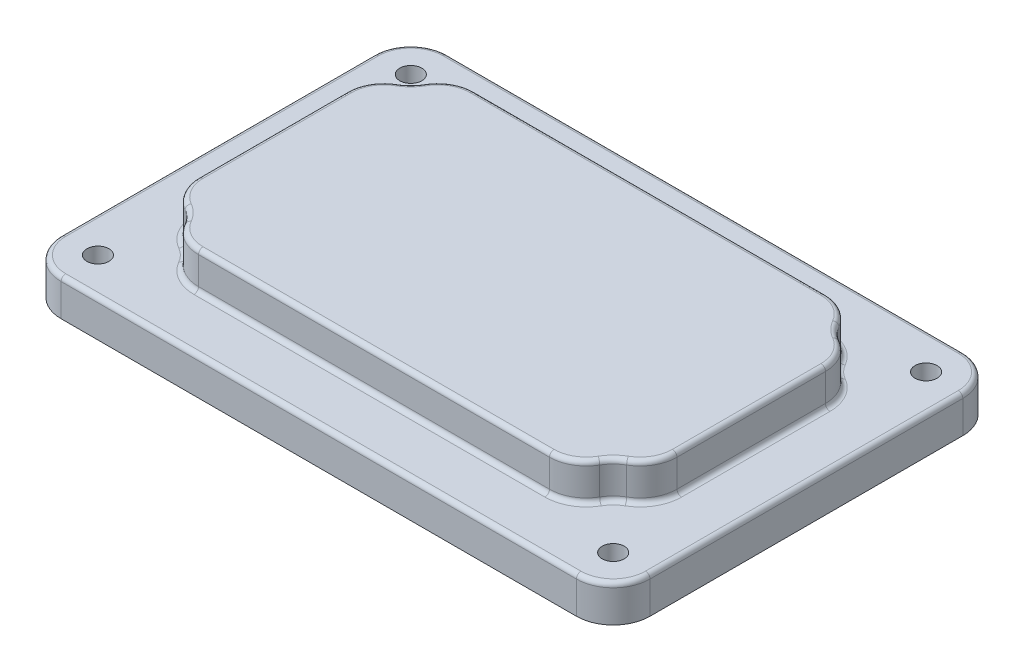
from build123d import *

# Parameters (mm, degrees)
BOSS_EXTRUDE1_DEPTH   = 6.35
SKETCH4_W             = 82.55
SKETCH4_H             = 47.625
BOSS_EXTRUDE2_DEPTH   = 6.35
SKETCH5_R             = 6.35
CUT_EXTRUDE1_DEPTH    = 6.35
FILLET1_R             = 6.35
SHELL1_T              = -3.175
BOSS_EXTRUDE3_REACH   = 64.075
SKETCH6_R             = 6.35
FILLET2_R             = 0.7874
FILLET3_R             = 0.7874
F_6_CLEARANCE_HOLE1_D = 3.7973


with BuildPart() as part:
    # Sketch3 → Boss-Extrude1 (new body)
    with BuildSketch(Plane(origin=(0, 0, 0), x_dir=(1, 0, 0), z_dir=(0, 1, 0))):
        with BuildLine():
            Line((-44.45, -33.3375), (44.45, -33.3375))
            ThreePointArc((44.45, -33.3375), (48.940128061, -31.477628061), (50.8, -26.9875))
            Line((50.8, -26.9875), (50.8, 26.9875))
            ThreePointArc((50.8, 26.9875), (48.940128061, 31.477628061), (44.45, 33.3375))
            Line((44.45, 33.3375), (-44.45, 33.3375))
            ThreePointArc((-44.45, 33.3375), (-48.940128061, 31.477628061), (-50.8, 26.9875))
            Line((-50.8, 26.9875), (-50.8, -26.9875))
            ThreePointArc((-50.8, -26.9875), (-48.940128061, -31.477628061), (-44.45, -33.3375))
        make_face()
    extrude(amount=BOSS_EXTRUDE1_DEPTH)

    # Sketch4 → Boss-Extrude2 (add)
    with BuildSketch(Plane(origin=(0, 6.35, 0), x_dir=(1, 0, 0), z_dir=(0, 1, 0))):
        Rectangle(SKETCH4_W, SKETCH4_H)
    extrude(amount=BOSS_EXTRUDE2_DEPTH)

    # Sketch5 → Cut-Extrude1 (cut)
    with BuildSketch(Plane(origin=(0, 12.7, 0), x_dir=(1, 0, 0), z_dir=(0, 1, 0))):
        with Locations((41.275, 23.8125)):
            Circle(SKETCH5_R)
        with Locations((-41.275, 23.8125)):
            Circle(SKETCH5_R)
        with Locations((-41.275, -23.8125)):
            Circle(SKETCH5_R)
        with Locations((41.275, -23.8125)):
            Circle(SKETCH5_R)
    extrude(amount=-CUT_EXTRUDE1_DEPTH, mode=Mode.SUBTRACT)

    # Fillet1
    fillet1_edges = [part.edges().sort_by_distance(p)[0] for p in [
        (34.925, 9.525, 23.8125),
        (41.275, 9.525, 17.4625),
        (-34.925, 9.525, 23.8125),
        (-41.275, 9.525, 17.4625),
        (-34.925, 9.525, -23.8125),
        (-41.275, 9.525, -17.4625),
        (41.275, 9.525, -17.4625),
        (34.925, 9.525, -23.8125),
    ]]
    fillet(fillet1_edges, radius=FILLET1_R)

    # Shell1
    shell1_openings = [part.faces().sort_by_distance(p)[0] for p in [
        (0, 0, 0),
    ]]
    offset(amount=SHELL1_T, openings=shell1_openings, kind=Kind.INTERSECTION)

    # Sketch6 → Boss-Extrude3 (add, up to next)
    with BuildSketch(Plane.XZ, mode=Mode.PRIVATE) as boss_extrude3_sk1:
        with Locations((-44.45, 26.9875)):
            Circle(SKETCH6_R)
    boss_extrude3_tool1 = extrude(boss_extrude3_sk1.sketch, amount=-BOSS_EXTRUDE3_REACH, mode=Mode.PRIVATE) - part.part
    # Sketch6 → Boss-Extrude3 (add, up to next)
    with BuildSketch(Plane.XZ, mode=Mode.PRIVATE) as boss_extrude3_sk2:
        with Locations((-44.45, -26.9875)):
            Circle(SKETCH6_R)
    boss_extrude3_tool2 = extrude(boss_extrude3_sk2.sketch, amount=-BOSS_EXTRUDE3_REACH, mode=Mode.PRIVATE) - part.part
    # Sketch6 → Boss-Extrude3 (add, up to next)
    with BuildSketch(Plane.XZ, mode=Mode.PRIVATE) as boss_extrude3_sk3:
        with Locations((44.45, -26.9875)):
            Circle(SKETCH6_R)
    boss_extrude3_tool3 = extrude(boss_extrude3_sk3.sketch, amount=-BOSS_EXTRUDE3_REACH, mode=Mode.PRIVATE) - part.part
    # Sketch6 → Boss-Extrude3 (add, up to next)
    with BuildSketch(Plane.XZ, mode=Mode.PRIVATE) as boss_extrude3_sk4:
        with Locations((44.45, 26.9875)):
            Circle(SKETCH6_R)
    boss_extrude3_tool4 = extrude(boss_extrude3_sk4.sketch, amount=-BOSS_EXTRUDE3_REACH, mode=Mode.PRIVATE) - part.part
    add(boss_extrude3_tool1.solids().sort_by_distance((-44.45, 0, 26.9875))[0])
    add(boss_extrude3_tool2.solids().sort_by_distance((-44.45, 0, -26.9875))[0])
    add(boss_extrude3_tool3.solids().sort_by_distance((44.45, 0, -26.9875))[0])
    add(boss_extrude3_tool4.solids().sort_by_distance((44.45, 0, 26.9875))[0])

    # Fillet2
    fillet2_edges = [part.edges().sort_by_distance(p)[0] for p in [
        (-41.275, 6.35, 0),
        (-36.784871939, 6.35, 19.322371939),
        (0, 6.35, 23.8125),
        (36.784871939, 6.35, 19.322371939),
        (40.424261314, 6.35, -15.988977372),
        (33.451477372, 6.35, -22.961761314),
        (-33.451477372, 6.35, -22.961761314),
        (-40.424261314, 6.35, -15.988977372),
        (-40.424261314, 6.35, 15.988977372),
        (33.451477372, 6.35, 22.961761314),
        (40.424261314, 6.35, 15.988977372),
        (-33.451477372, 6.35, 22.961761314),
        (48.940128061, 6.35, -31.477628061),
        (0, 6.35, -33.3375),
        (-48.940128061, 6.35, -31.477628061),
        (-50.8, 6.35, 0),
        (-48.940128061, 6.35, 31.477628061),
        (0, 6.35, 33.3375),
        (48.940128061, 6.35, 31.477628061),
        (41.275, 12.7, 0),
        (41.275, 6.35, 0),
        (36.784871939, 12.7, 19.322371939),
        (36.784871939, 12.7, -19.322371939),
        (0, 12.7, -23.8125),
        (-36.784871939, 12.7, -19.322371939),
        (-41.275, 12.7, 0),
        (-36.784871939, 12.7, 19.322371939),
        (0, 12.7, 23.8125),
        (50.8, 6.35, 0),
        (-33.451477372, 12.7, 22.961761314),
        (40.424261314, 12.7, 15.988977372),
        (33.451477372, 12.7, 22.961761314),
        (-40.424261314, 12.7, 15.988977372),
        (-40.424261314, 12.7, -15.988977372),
        (-33.451477372, 12.7, -22.961761314),
        (33.451477372, 12.7, -22.961761314),
        (40.424261314, 12.7, -15.988977372),
        (36.784871939, 6.35, -19.322371939),
        (0, 6.35, -23.8125),
        (-36.784871939, 6.35, -19.322371939),
    ]]
    fillet(fillet2_edges, radius=FILLET2_R)

    # Fillet3
    fillet3_edges = [part.edges().sort_by_distance(p)[0] for p in [
        (37.674630657, 3.175, 14.401477372),
        (31.863977372, 3.175, 20.212130657),
        (-31.863977372, 3.175, 20.212130657),
        (-37.674630657, 3.175, 14.401477372),
        (-37.674630657, 3.175, -14.401477372),
        (-31.863977372, 3.175, -20.212130657),
        (31.863977372, 3.175, -20.212130657),
        (37.674630657, 3.175, -14.401477372),
        (0, 3.175, 20.6375),
        (38.1, 3.175, 0),
        (0, 3.175, -20.6375),
        (-38.1, 3.175, 0),
        (38.1, 9.525, 0),
        (37.674630657, 9.525, -14.401477372),
        (31.863977372, 9.525, -20.212130657),
        (0, 9.525, -20.6375),
        (-31.863977372, 9.525, -20.212130657),
        (-37.674630657, 9.525, -14.401477372),
        (-38.1, 9.525, 0),
        (-37.674630657, 9.525, 14.401477372),
        (-31.863977372, 9.525, 20.212130657),
        (0, 9.525, 20.6375),
        (31.863977372, 9.525, 20.212130657),
        (37.674630657, 9.525, 14.401477372),
        (34.539807909, 9.525, -17.077307909),
        (34.539807909, 3.175, -17.077307909),
        (-34.539807909, 9.525, -17.077307909),
        (-34.539807909, 3.175, -17.077307909),
        (-34.539807909, 9.525, 17.077307909),
        (-34.539807909, 3.175, 17.077307909),
        (34.539807909, 9.525, 17.077307909),
        (34.539807909, 3.175, 17.077307909),
        (0, 3.175, 30.1625),
        (-47.625, 3.175, 0),
        (0, 3.175, -30.1625),
        (47.625, 3.175, 0),
        (-39.959871939, 3.175, 22.497371939),
        (-39.959871939, 3.175, -22.497371939),
        (39.959871939, 3.175, -22.497371939),
        (39.959871939, 3.175, 22.497371939),
        (0, 0, 30.1625),
        (-47.625, 0, 0),
        (0, 0, -30.1625),
        (47.625, 0, 0),
        (39.959871939, 0, 22.497371939),
        (47.625, 1.5875, 21.488238686),
        (38.950738686, 1.5875, 30.1625),
        (39.959871939, 0, -22.497371939),
        (47.625, 1.5875, -21.488238686),
        (38.950738686, 1.5875, -30.1625),
        (-39.959871939, 0, -22.497371939),
        (-38.950738686, 1.5875, -30.1625),
        (-47.625, 1.5875, -21.488238686),
        (-39.959871939, 0, 22.497371939),
        (-47.625, 1.5875, 21.488238686),
        (-38.950738686, 1.5875, 30.1625),
    ]]
    fillet(fillet3_edges, radius=FILLET3_R)

    # #6 Clearance Hole1 (through all)
    with Locations(Plane(origin=(0, 0, 0), x_dir=(-1, 0, 0), z_dir=(0, -1, 0))):
        with Locations((-44.45, 26.9875), (44.45, 26.9875), (44.45, -26.9875), (-44.45, -26.9875)):
            Hole(F_6_CLEARANCE_HOLE1_D / 2)


solid = part.part
